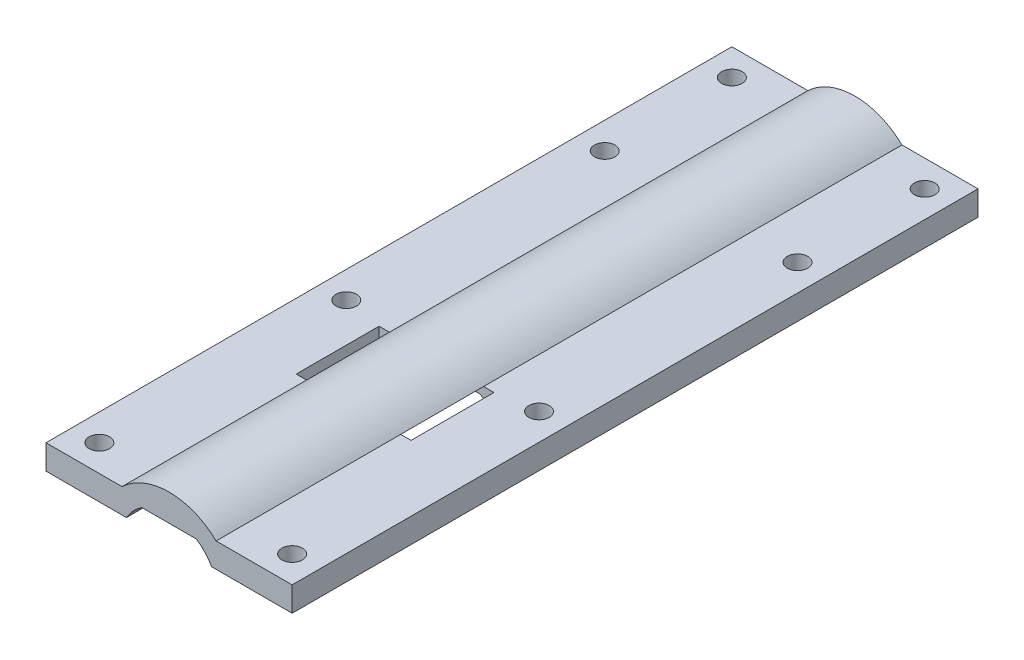
from build123d import *

# Parameters (mm, degrees)
BOSS_EXTRUDE1_DEPTH = 22
SKETCH4_R           = 1.25
CUT_EXTRUDE1_DEPTH  = 3
BOSS_EXTRUDE2_DEPTH = 27
BOSS_EXTRUDE3_START = 27
BOSS_EXTRUDE3_DEPTH = 11.1
BOSS_EXTRUDE5_DEPTH = 23.5
SKETCH8_R           = 1.25
CUT_EXTRUDE2_DEPTH  = 3
SKETCH9_W           = 14
SKETCH9_H           = 10.1
CUT_EXTRUDE3_DEPTH  = 3


with BuildPart() as part:
    # Sketch3 → Boss-Extrude1 (new body)
    with BuildSketch(Plane.XY):
        with BuildLine():
            Line((-15, 3), (-4.369210455, 3))
            ThreePointArc((-4.369210455, 3), (0, 5.3), (4.369210455, 3))
            Line((4.369210455, 3), (15, 3))
            Line((15, 3), (15, 6))
            Line((15, 6), (5.734980384, 6))
            ThreePointArc((5.734980384, 6), (0, 8.3), (-5.734980384, 6))
            Line((-5.734980384, 6), (-15, 6))
            Line((-15, 6), (-15, 3))
        make_face()
    extrude(amount=BOSS_EXTRUDE1_DEPTH)

    # Sketch4 → Cut-Extrude1 (cut)
    with BuildSketch(Plane(origin=(0, 6, 0), x_dir=(1, 0, 0), z_dir=(0, 1, 0))):
        with Locations(Location((11.75, -18.75, 0), (0, 0, 180))):
            Circle(SKETCH4_R)
        with Locations(Location((11.75, -3.25, 0), (0, 0, 180))):
            Circle(SKETCH4_R)
        with Locations(Location((-11.75, -3.25, 0), (0, 0, 180))):
            Circle(SKETCH4_R)
        with Locations(Location((-11.75, -18.75, 0), (0, 0, 180))):
            Circle(SKETCH4_R)
    extrude(amount=-CUT_EXTRUDE1_DEPTH, mode=Mode.SUBTRACT)

    # Sketch5 → Boss-Extrude2 (add)
    with BuildSketch(Plane.XY.offset(22)):
        with BuildLine():
            Line((6, 4), (6, 3))
            Line((6, 3), (15, 3))
            Line((15, 3), (15, 6))
            Line((15, 6), (5.734980384, 6))
            ThreePointArc((5.734980384, 6), (0, 8.3), (-5.734980384, 6))
            Line((-5.734980384, 6), (-15, 6))
            Line((-15, 6), (-15, 3))
            Line((-15, 3), (-6, 3))
            Line((-6, 3), (-6, 4))
            ThreePointArc((-6, 4), (-5.707106781, 4.707106781), (-5, 5))
            Line((-5, 5), (-1.757839583, 5))
            ThreePointArc((-1.757839583, 5), (0, 5.3), (1.757839583, 5))
            Line((1.757839583, 5), (5, 5))
            ThreePointArc((5, 5), (5.707106781, 4.707106781), (6, 4))
        make_face()
        with BuildLine():
            ThreePointArc((-4.369210455, 3), (-3.222605397, 4.207708932), (-1.757839583, 5))
            Line((-1.757839583, 5), (-5, 5))
            ThreePointArc((-5, 5), (-5.707106781, 4.707106781), (-6, 4))
            Line((-6, 4), (-6, 3))
            Line((-6, 3), (-4.369210455, 3))
        make_face()
        with BuildLine():
            Line((4.369210455, 3), (6, 3))
            Line((6, 3), (6, 4))
            ThreePointArc((6, 4), (5.707106781, 4.707106781), (5, 5))
            Line((5, 5), (1.757839583, 5))
            ThreePointArc((1.757839583, 5), (3.222605397, 4.207708932), (4.369210455, 3))
        make_face()
    extrude(amount=BOSS_EXTRUDE2_DEPTH)

    # Sketch5<3> → Boss-Extrude3 (add)
    with BuildSketch(Plane.XY.offset(22).offset(BOSS_EXTRUDE3_START)):
        with BuildLine():
            Line((6, 4), (6, 3))
            Line((6, 3), (15, 3))
            Line((15, 3), (15, 6))
            Line((15, 6), (5.734980384, 6))
            ThreePointArc((5.734980384, 6), (0, 8.3), (-5.734980384, 6))
            Line((-5.734980384, 6), (-15, 6))
            Line((-15, 6), (-15, 3))
            Line((-15, 3), (-6, 3))
            Line((-6, 3), (-6, 4))
            ThreePointArc((-6, 4), (-5.707106781, 4.707106781), (-5, 5))
            Line((-5, 5), (-1.757839583, 5))
            ThreePointArc((-1.757839583, 5), (0, 5.3), (1.757839583, 5))
            Line((1.757839583, 5), (5, 5))
            ThreePointArc((5, 5), (5.707106781, 4.707106781), (6, 4))
        make_face()
    extrude(amount=BOSS_EXTRUDE3_DEPTH)

    # Sketch7 → Boss-Extrude5 (add)
    with BuildSketch(Plane.XY.offset(60.1)):
        with BuildLine():
            Line((-15, 6), (-15, 3))
            Line((-15, 3), (-6, 3))
            Line((-6, 3), (-6, 4))
            ThreePointArc((-6, 4), (-5.707106781, 4.707106781), (-5, 5))
            Line((-5, 5), (-1.757839583, 5))
            ThreePointArc((-1.757839583, 5), (0, 5.3), (1.757839583, 5))
            Line((1.757839583, 5), (5, 5))
            ThreePointArc((5, 5), (5.707106781, 4.707106781), (6, 4))
            Line((6, 4), (6, 3))
            Line((6, 3), (15, 3))
            Line((15, 3), (15, 6))
            Line((15, 6), (5.734980384, 6))
            ThreePointArc((5.734980384, 6), (0, 8.3), (-5.734980384, 6))
            Line((-5.734980384, 6), (-15, 6))
        make_face()
        with BuildLine():
            ThreePointArc((-5.196152423, 3), (-4.372281323, 4.108911782), (-3.31662479, 5))
            Line((-3.31662479, 5), (-5, 5))
            ThreePointArc((-5, 5), (-5.707106781, 4.707106781), (-6, 4))
            Line((-6, 4), (-6, 3))
            Line((-6, 3), (-5.196152423, 3))
        make_face()
        with BuildLine():
            Line((5, 5), (3.31662479, 5))
            ThreePointArc((3.31662479, 5), (4.372281323, 4.108911782), (5.196152423, 3))
            Line((5.196152423, 3), (6, 3))
            Line((6, 3), (6, 4))
            ThreePointArc((6, 4), (5.707106781, 4.707106781), (5, 5))
        make_face()
        with BuildLine():
            Line((-1.757839583, 5), (1.757839583, 5))
            ThreePointArc((1.757839583, 5), (0, 5.3), (-1.757839583, 5))
        make_face()
    extrude(amount=BOSS_EXTRUDE5_DEPTH)

    # Sketch8 → Cut-Extrude2 (cut)
    with BuildSketch(Plane(origin=(0, 6, 0), x_dir=(1, 0, 0), z_dir=(0, 1, 0))):
        with Locations(Location((-11.75, -80.35, 0), (0, 0, 180))):
            Circle(SKETCH8_R)
        with Locations(Location((-11.75, -50.25, 0), (0, 0, 180))):
            Circle(SKETCH8_R)
        with Locations(Location((11.75, -50.25, 0), (0, 0, 180))):
            Circle(SKETCH8_R)
        with Locations(Location((11.75, -80.35, 0), (0, 0, 180))):
            Circle(SKETCH8_R)
    extrude(amount=-CUT_EXTRUDE2_DEPTH, mode=Mode.SUBTRACT)

    # Sketch9 → Cut-Extrude3 (cut)
    with BuildSketch(Plane.XZ.offset(-3)):
        with Locations((0, 56.05)):
            Rectangle(SKETCH9_W, SKETCH9_H)
    extrude(amount=-CUT_EXTRUDE3_DEPTH, mode=Mode.SUBTRACT)


solid = part.part
